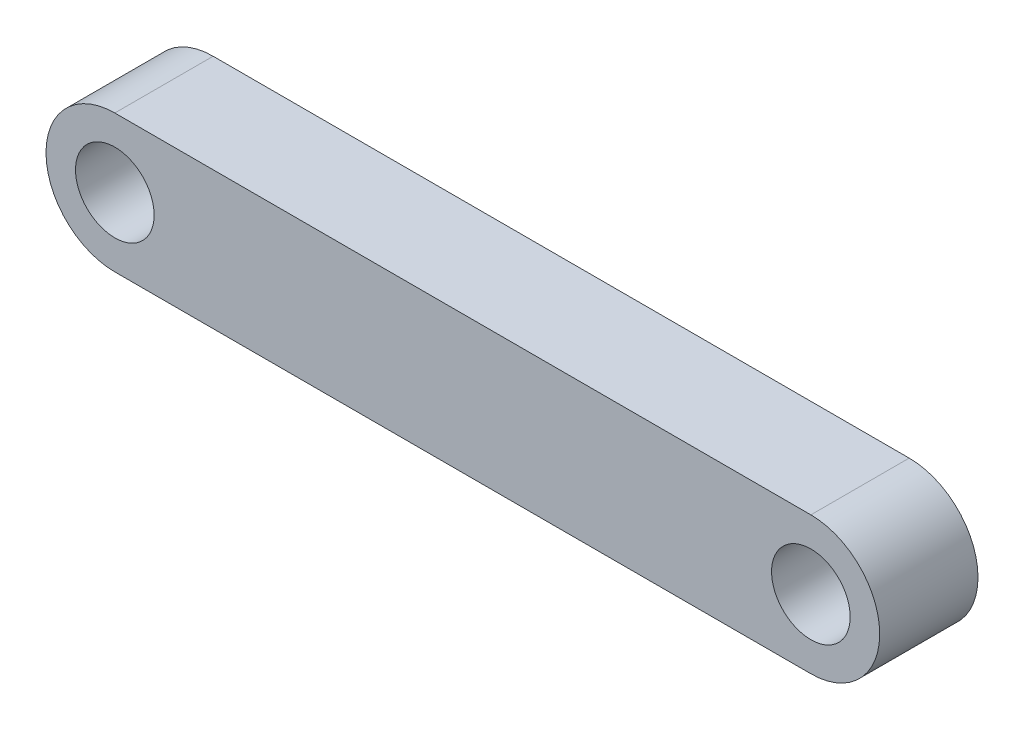
from build123d import *

# Parameters (mm, degrees)
SKETCH_2_R      = 20
EXTRUDE_1_DEPTH = 50


with BuildPart() as part:
    # 草图2 → 凸台-拉伸1 (new body)
    with BuildSketch(Plane.XY):
        with BuildLine():
            Line((0, 35), (354, 35))
            ThreePointArc((354, 35), (389, 0), (354, -35))
            Line((354, -35), (0, -35))
            ThreePointArc((0, -35), (-35, 0), (0, 35))
        make_face()
        Circle(SKETCH_2_R, mode=Mode.SUBTRACT)
        with Locations((354, 0)):
            Circle(SKETCH_2_R, mode=Mode.SUBTRACT)
    extrude(amount=EXTRUDE_1_DEPTH)


solid = part.part
